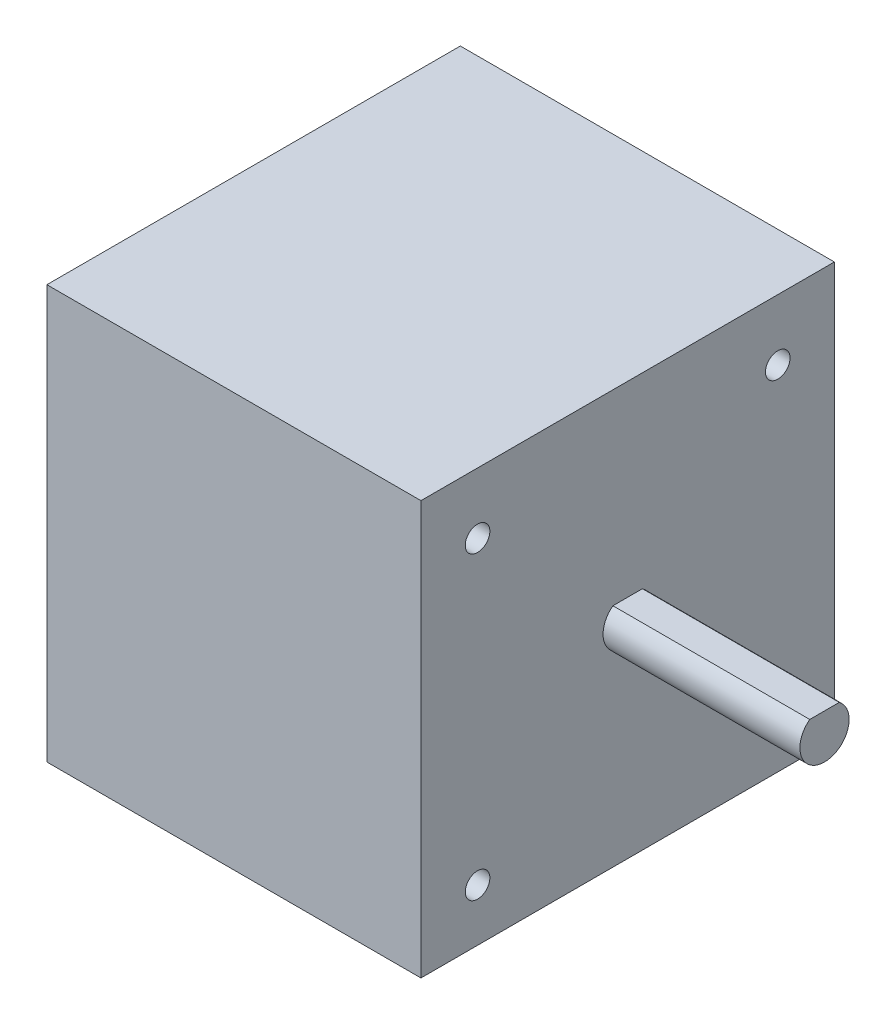
from build123d import *

# Parameters (mm, degrees)
SKETCH_1_W          = 42
SKETCH_1_H          = 42
EXTRUDE_1_DEPTH     = 38
EXTRUDE_2_DEPTH     = 20
SKETCH_3_R          = 1.25
CUT_EXTRUDE_1_DEPTH = 20


with BuildPart() as part:
    # 草图1 → 凸台-拉伸1 (new body)
    with BuildSketch(Plane(origin=(0, 0, 0), x_dir=(0, 0, -1), z_dir=(1, 0, 0))):
        Rectangle(SKETCH_1_W, SKETCH_1_H)
    extrude(amount=EXTRUDE_1_DEPTH)

    # 草图2 → 凸台-拉伸2 (add)
    with BuildSketch(Plane(origin=(38, 0, 0), x_dir=(0, 0, -1), z_dir=(1, 0, 0))):
        with BuildLine():
            Line((-1.5, 2), (1.5, 2))
            ThreePointArc((1.5, 2), (0, -2.5), (-1.5, 2))
        make_face()
    extrude(amount=EXTRUDE_2_DEPTH)

    # 草图3 → 切除-拉伸1 (cut)
    with BuildSketch(Plane(origin=(38, 0, 0), x_dir=(0, 0, -1), z_dir=(1, 0, 0))):
        with Locations((-15.25, 14.812372141)):
            Circle(SKETCH_3_R)
        with Locations((15.25, 14.812372141)):
            Circle(SKETCH_3_R)
        with Locations((15.476779335, -15.687627859)):
            Circle(SKETCH_3_R)
        with Locations((-15.25, -15.687627859)):
            Circle(SKETCH_3_R)
    extrude(amount=-CUT_EXTRUDE_1_DEPTH, mode=Mode.SUBTRACT)


solid = part.part
